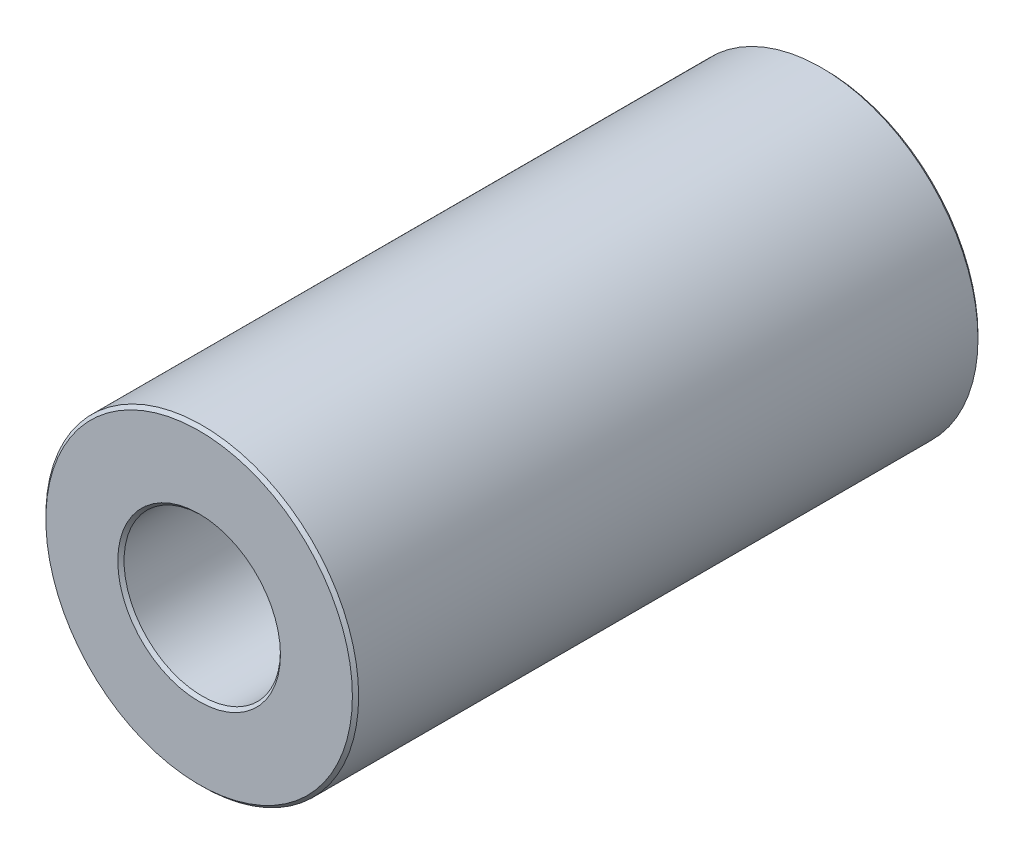
from build123d import *

# Parameters (mm, degrees)
SKETCH2_R           = 12.7
SKETCH2_R_2         = 6.35
BOSS_EXTRUDE1_DEPTH = 25.4
CHAMFER1_SIZE       = 0.254


with BuildPart() as part:
    # Sketch2 → Boss-Extrude1 (new, symmetric)
    with BuildSketch(Plane.XY):
        Circle(SKETCH2_R)
        Circle(SKETCH2_R_2, mode=Mode.SUBTRACT)
    extrude(amount=BOSS_EXTRUDE1_DEPTH, both=True)

    # Chamfer1
    chamfer1_edges = [part.edges().sort_by_distance(p)[0] for p in [
        (-12.7, 0, -25.4),
        (-12.7, 0, 25.4),
        (-6.35, 0, -25.4),
        (-6.35, 0, 25.4),
    ]]
    chamfer(chamfer1_edges, length=CHAMFER1_SIZE)


solid = part.part
